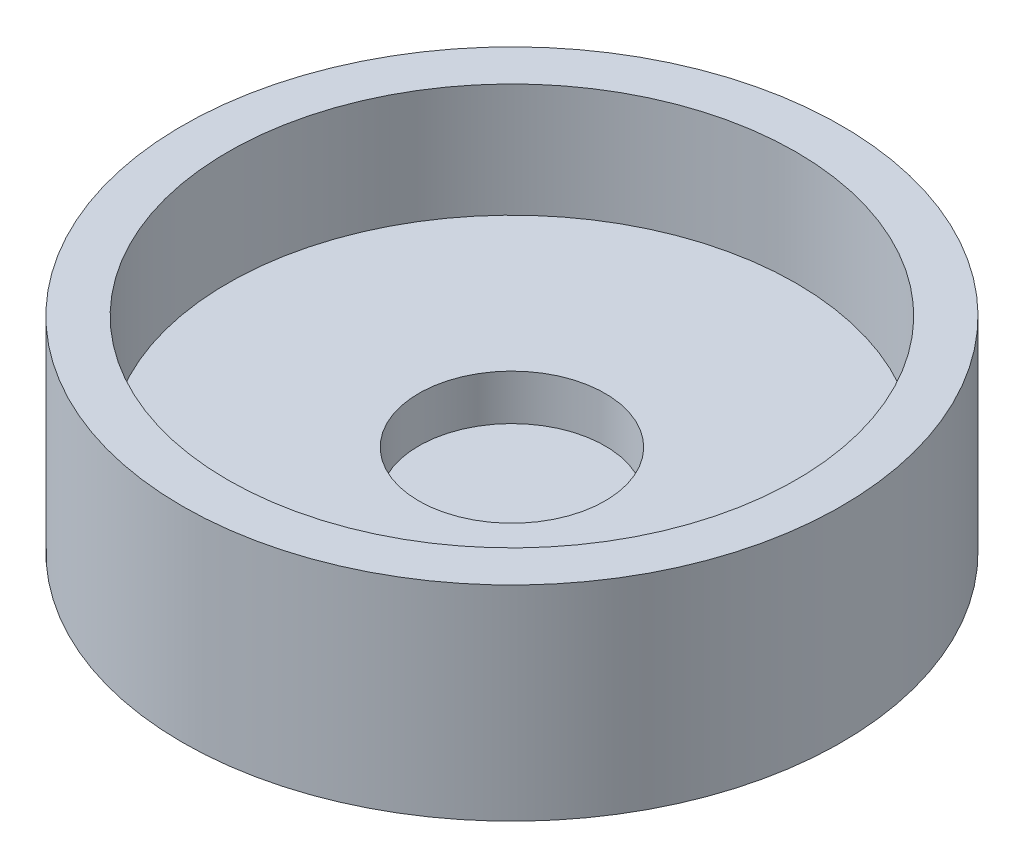
from build123d import *

# Parameters (mm, degrees)
SKETCH2_R           = 14.5
SKETCH2_R_2         = 12.5
BOSS_EXTRUDE1_DEPTH = 5
BOSS_EXTRUDE2_START = -4
SKETCH2_3_R         = 14.5
BOSS_EXTRUDE2_DEPTH = 4
SKETCH3_R           = 4.1
CUT_EXTRUDE1_DEPTH  = 2


with BuildPart() as part:
    # Sketch2 → Boss-Extrude1 (new body)
    with BuildSketch(Plane(origin=(0, 0, 0), x_dir=(1, 0, 0), z_dir=(0, 1, 0))):
        Circle(SKETCH2_R)
        Circle(SKETCH2_R_2, mode=Mode.SUBTRACT)
    extrude(amount=BOSS_EXTRUDE1_DEPTH)

    # Sketch2<3> → Boss-Extrude2 (add)
    with BuildSketch(Plane(origin=(0, 0, 0), x_dir=(1, 0, 0), z_dir=(0, 1, 0)).offset(BOSS_EXTRUDE2_START)):
        Circle(SKETCH2_3_R)
    extrude(amount=BOSS_EXTRUDE2_DEPTH)

    # Sketch3 → Cut-Extrude1 (cut)
    with BuildSketch(Plane(origin=(0, 0, 0), x_dir=(1, 0, 0), z_dir=(0, 1, 0))):
        Circle(SKETCH3_R)
    extrude(amount=-CUT_EXTRUDE1_DEPTH, mode=Mode.SUBTRACT)


solid = part.part
